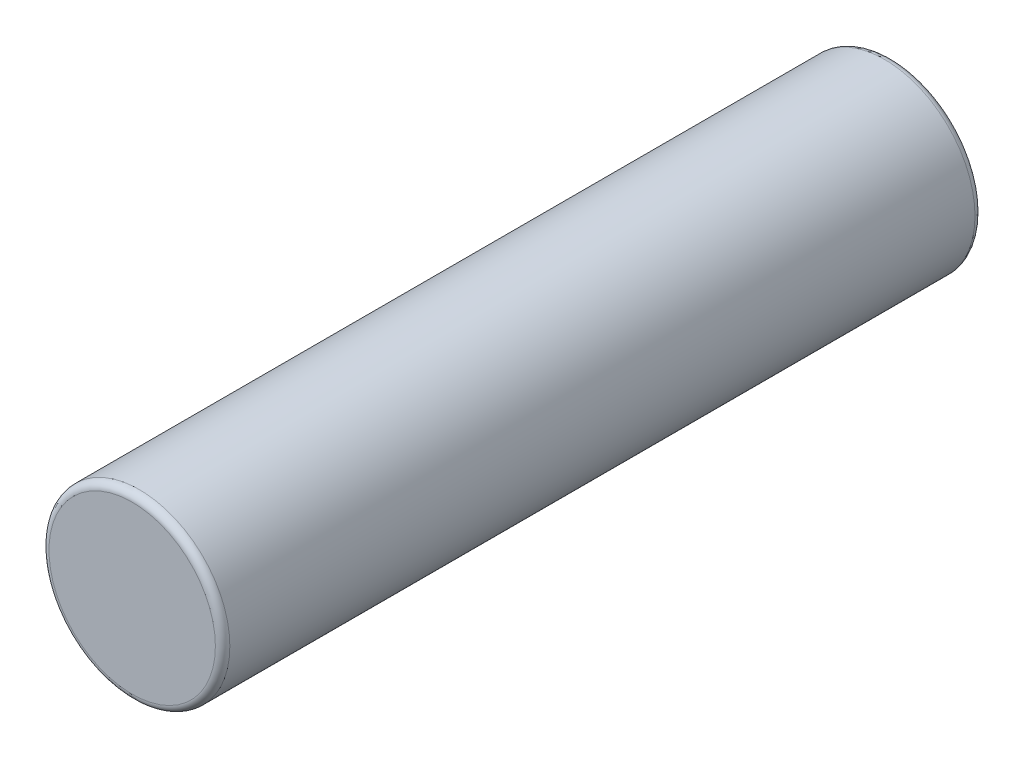
from build123d import *

# Parameters (mm, degrees)
ESQUISSE1_R      = 2.5
EXTRUSION1_DEPTH = 10.5
CONG_1_R         = 0.2


with BuildPart() as part:
    # Esquisse1 → Extrusion1 (new, symmetric)
    with BuildSketch(Plane.XY):
        with Locations(Location((0, 0, 0), (0, 0, 180))):
            Circle(ESQUISSE1_R)
    extrude(amount=EXTRUSION1_DEPTH, both=True)

    # Congé1
    cong_1_edges = [part.edges().sort_by_distance(p)[0] for p in [
        (2.5, 0, -10.5),
        (2.5, 0, 10.5),
    ]]
    fillet(cong_1_edges, radius=CONG_1_R)


solid = part.part
